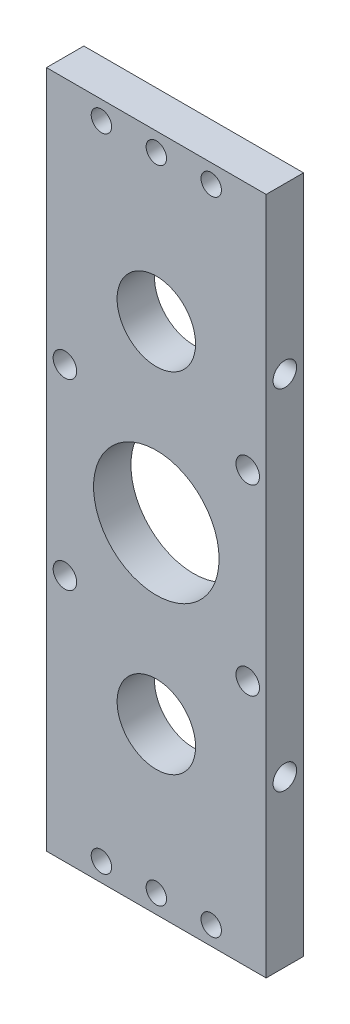
from build123d import *

# Parameters (mm, degrees)
ESBO_O1_W                = 56
ESBO_O1_H                = 173
RESSALTO_EXTRUS_O1_DEPTH = 9.525
ESBO_O2_R                = 16
ESBO_O2_R_2              = 10
ESBO_O2_R_3              = 2.6
CORTE_EXTRUS_O1_DEPTH    = 9.525
CORTAR_EXTRUIR2_REACH    = 105.484
CROQUIS1_R               = 2
CROQUIS2_R               = 3
CORTAR_EXTRUIR3_DEPTH    = 7
ESBO_O3_R                = 3
CORTE_EXTRUS_O2_DEPTH    = 92.416495376


with BuildPart() as part:
    # Esboço1 → Ressalto-extrusão1 (new body)
    with BuildSketch(Plane.XY):
        Rectangle(ESBO_O1_W, ESBO_O1_H)
    extrude(amount=RESSALTO_EXTRUS_O1_DEPTH)

    # Esboço2 → Corte-extrusão1 (cut)
    with BuildSketch(Plane.XY.offset(9.525)):
        Circle(ESBO_O2_R)
        with Locations((0, 44.47)):
            Circle(ESBO_O2_R_2)
        with Locations((0, -44.47)):
            Circle(ESBO_O2_R_2)
        with Locations((0, 81.74)):
            Circle(ESBO_O2_R_3)
        with Locations((14, 81.74)):
            Circle(ESBO_O2_R_3)
        with Locations((-14, 81.74)):
            Circle(ESBO_O2_R_3)
        with Locations((14, -81.74)):
            Circle(ESBO_O2_R_3)
        with Locations((0, -81.74)):
            Circle(ESBO_O2_R_3)
        with Locations((-14, -81.74)):
            Circle(ESBO_O2_R_3)
    extrude(amount=-CORTE_EXTRUS_O1_DEPTH, mode=Mode.SUBTRACT)

    # Croquis1 → Cortar-Extruir2 (cut, up to next)
    with BuildSketch(Plane(origin=(28, 0, 0), x_dir=(0, 0, -1), z_dir=(1, 0, 0)), mode=Mode.PRIVATE) as cortar_extruir2_sk1:
        with Locations(Location((-4.7625, -44.47, 0), (0, 0, 90))):
            Circle(CROQUIS1_R)
    cortar_extruir2_tool1 = extrude(cortar_extruir2_sk1.sketch, amount=-CORTAR_EXTRUIR2_REACH, mode=Mode.PRIVATE) & part.part
    # Croquis1 → Cortar-Extruir2 (cut, up to next)
    with BuildSketch(Plane(origin=(28, 0, 0), x_dir=(0, 0, -1), z_dir=(1, 0, 0)), mode=Mode.PRIVATE) as cortar_extruir2_sk2:
        with Locations(Location((-4.7625, 44.47, 0), (0, 0, 90))):
            Circle(CROQUIS1_R)
    cortar_extruir2_tool2 = extrude(cortar_extruir2_sk2.sketch, amount=-CORTAR_EXTRUIR2_REACH, mode=Mode.PRIVATE) & part.part
    add(cortar_extruir2_tool1.solids().sort_by_distance((28, -44.47, 4.7625))[0], mode=Mode.SUBTRACT)
    add(cortar_extruir2_tool2.solids().sort_by_distance((28, 44.47, 4.7625))[0], mode=Mode.SUBTRACT)

    # Croquis2 → Cortar-Extruir3 (cut)
    with BuildSketch(Plane(origin=(28, 0, 0), x_dir=(0, 0, -1), z_dir=(1, 0, 0))):
        with Locations(Location((-4.7625, -44.47, 0), (0, 0, 90))):
            Circle(CROQUIS2_R)
        with Locations(Location((-4.7625, 44.47, 0), (0, 0, 90))):
            Circle(CROQUIS2_R)
    extrude(amount=-CORTAR_EXTRUIR3_DEPTH, mode=Mode.SUBTRACT)

    # Esboço3 → Corte-extrusão2 (cut, through all)
    with BuildSketch(Plane.XY.offset(9.525)):
        with Locations((-23.3, 23.3)):
            Circle(ESBO_O3_R)
        with Locations((23.3, 23.3)):
            Circle(ESBO_O3_R)
        with Locations((23.3, -23.3)):
            Circle(ESBO_O3_R)
        with Locations((-23.3, -23.3)):
            Circle(ESBO_O3_R)
    extrude(amount=-CORTE_EXTRUS_O2_DEPTH, mode=Mode.SUBTRACT)


solid = part.part
